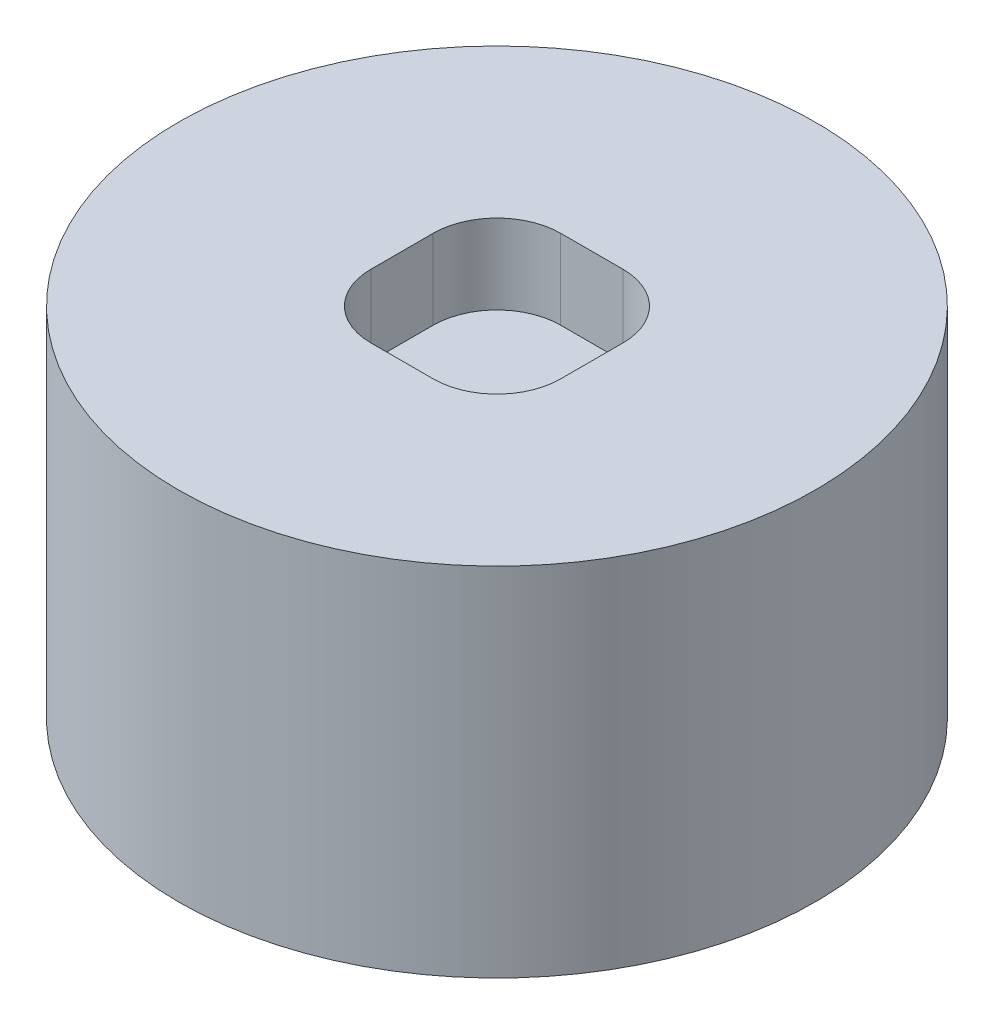
from build123d import *

# Parameters (mm, degrees)
SKETCH1_R           = 10
SKETCH1_R_2         = 8.985
BOSS_EXTRUDE1_DEPTH = 0.7
SKETCH2_R           = 10
SKETCH2_R_2         = 6
BOSS_EXTRUDE2_DEPTH = 7
SKETCH3_R           = 10
BOSS_EXTRUDE3_DEPTH = 1
SKETCH4_R           = 10
BOSS_EXTRUDE4_DEPTH = 2.5


with BuildPart() as part:
    # Sketch1 → Boss-Extrude1 (new body)
    with BuildSketch(Plane(origin=(0, 0, 0), x_dir=(1, 0, 0), z_dir=(0, 1, 0))):
        with Locations(Location((0, 0, 0), (0, 0, 270))):
            Circle(SKETCH1_R)
        with Locations(Location((0, 0, 0), (0, 0, 270))):
            Circle(SKETCH1_R_2, mode=Mode.SUBTRACT)
    extrude(amount=BOSS_EXTRUDE1_DEPTH)

    # Sketch2 → Boss-Extrude2 (add)
    with BuildSketch(Plane(origin=(0, 0.7, 0), x_dir=(1, 0, 0), z_dir=(0, 1, 0))):
        with Locations(Location((0, 0, 0), (0, 0, 270))):
            Circle(SKETCH2_R)
        with Locations(Location((0, 0, 0), (0, 0, 270))):
            Circle(SKETCH2_R_2, mode=Mode.SUBTRACT)
    extrude(amount=BOSS_EXTRUDE2_DEPTH)

    # Sketch3 → Boss-Extrude3 (add)
    with BuildSketch(Plane(origin=(0, 7.7, 0), x_dir=(1, 0, 0), z_dir=(0, 1, 0))):
        with Locations(Location((0, 0, 0), (0, 0, 270))):
            Circle(SKETCH3_R)
    extrude(amount=BOSS_EXTRUDE3_DEPTH)

    # Sketch4 → Boss-Extrude4 (add)
    with BuildSketch(Plane(origin=(0, 8.7, 0), x_dir=(1, 0, 0), z_dir=(0, 1, 0))):
        with Locations(Location((0, 0, 0), (0, 0, 270))):
            Circle(SKETCH4_R)
        with BuildLine():
            Line((-0.98, 2.98), (0.98, 2.98))
            ThreePointArc((0.98, 2.98), (2.394213562, 2.394213562), (2.98, 0.98))
            Line((2.98, 0.98), (2.98, -0.98))
            ThreePointArc((2.98, -0.98), (2.394213562, -2.394213562), (0.98, -2.98))
            Line((0.98, -2.98), (-0.98, -2.98))
            ThreePointArc((-0.98, -2.98), (-2.394213562, -2.394213562), (-2.98, -0.98))
            Line((-2.98, -0.98), (-2.98, 0.98))
            ThreePointArc((-2.98, 0.98), (-2.394213562, 2.394213562), (-0.98, 2.98))
        make_face(mode=Mode.SUBTRACT)
    extrude(amount=BOSS_EXTRUDE4_DEPTH)


solid = part.part
